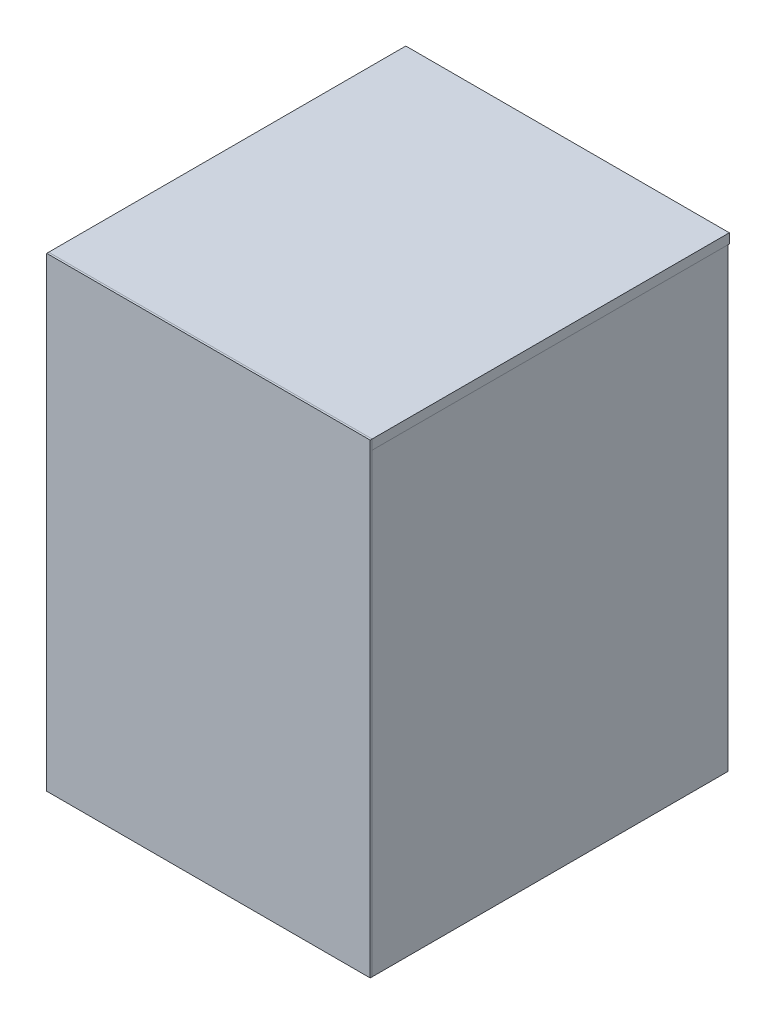
from build123d import *

# Parameters (mm, degrees)
SKETCH1_W                       = 15
SKETCH1_H                       = 705
BOSS_EXTRUDE1_DEPTH             = 550
BOSS_EXTRUDE1_2_DEPTH           = 550
BOSS_EXTRUDE2_START             = 20
SKETCH2_W                       = 470
SKETCH2_H                       = 15
BOSS_EXTRUDE2_DEPTH             = 515
BOSS_EXTRUDE3_START             = -2
SKETCH3_W                       = 500
SKETCH3_H                       = 15
BOSS_EXTRUDE3_DEPTH             = 552
SKETCH4_W                       = 470
SKETCH4_H                       = 15
BOSS_EXTRUDE4_DEPTH             = 50
BOSS_EXTRUDE5_REACH             = 930.453
SKETCH5_W                       = 15
SKETCH5_H                       = 50
SKETCH5_H_2                     = 105
BOSS_EXTRUDE5_DIRECTION_2_REACH = 930.453
SKETCH7_W                       = 500
SKETCH7_H                       = 720
BOSS_EXTRUDE6_DEPTH             = 3
CUT_EXTRUDE2_DEPTH              = 15
ALU_PROFILES_DEPTH              = 585
SKETCH9_R                       = 2.5
CUT_EXTRUDE1_DEPTH              = 2


with BuildPart() as part:
    # Sketch1 → Boss-Extrude1 (new body)
    with BuildSketch(Plane.XY):
        with Locations((-242.5, 337.5)):
            Rectangle(SKETCH1_W, SKETCH1_H)
    extrude(amount=BOSS_EXTRUDE1_DEPTH)



with BuildPart() as body_2:
    # Sketch1 → Boss-Extrude1 2 (new body)
    with BuildSketch(Plane.XY):
        with Locations((242.5, 337.5)):
            Rectangle(SKETCH1_W, SKETCH1_H)
    extrude(amount=BOSS_EXTRUDE1_2_DEPTH)


with BuildPart() as body_3:
    # Sketch2 → Boss-Extrude2 (new body)
    with BuildSketch(Plane.XY.offset(BOSS_EXTRUDE2_START)):
        with Locations((0, -7.5)):
            Rectangle(SKETCH2_W, SKETCH2_H)
    extrude(amount=BOSS_EXTRUDE2_DEPTH)


with BuildPart() as body_4:
    # Sketch3 → Boss-Extrude3 (new body)
    with BuildSketch(Plane.XY.offset(BOSS_EXTRUDE3_START)):
        with Locations((0, 697.5)):
            Rectangle(SKETCH3_W, SKETCH3_H)
    extrude(amount=BOSS_EXTRUDE3_DEPTH)


with BuildPart() as part_1:
    add(part.part)

    add(body_2.part)  # Boss-Extrude4 merges body 2
    # Sketch4 → Boss-Extrude4 (add)
    with BuildSketch(Plane(origin=(0, 0, 20), x_dir=(-1, 0, 0), z_dir=(0, 0, -1))):
        with Locations((0, 592.5)):
            Rectangle(SKETCH4_W, SKETCH4_H)
    extrude(amount=-BOSS_EXTRUDE4_DEPTH)


with BuildPart() as body_4_2:

    # Sketch5 → Boss-Extrude5 (new, up to next)
    with BuildSketch(Plane(origin=(0, 0, 0), x_dir=(0, 0, -1), z_dir=(1, 0, 0)), mode=Mode.PRIVATE) as boss_extrude5_sk1:
        with Locations((-542.5, 665)):
            Rectangle(SKETCH5_W, SKETCH5_H)
    boss_extrude5_tool1 = extrude(boss_extrude5_sk1.sketch, amount=BOSS_EXTRUDE5_REACH, mode=Mode.PRIVATE) - part_1.part
    # Sketch5 → Boss-Extrude5 (new, up to next)
    with BuildSketch(Plane(origin=(0, 0, 0), x_dir=(0, 0, -1), z_dir=(1, 0, 0)), mode=Mode.PRIVATE) as boss_extrude5_sk2:
        with Locations((-77.5, 637.5)):
            Rectangle(SKETCH5_W, SKETCH5_H_2)
    boss_extrude5_tool2 = extrude(boss_extrude5_sk2.sketch, amount=BOSS_EXTRUDE5_REACH, mode=Mode.PRIVATE) - part_1.part
    add(boss_extrude5_tool1.solids().sort_by_distance((0, 665, 542.5))[0])
    add(boss_extrude5_tool2.solids().sort_by_distance((0, 637.5, 77.5))[0])


    # Sketch5 → Boss-Extrude5 direction 2 (add, up to next)
    with BuildSketch(Plane(origin=(0, 0, 0), x_dir=(0, 0, -1), z_dir=(1, 0, 0)), mode=Mode.PRIVATE) as boss_extrude5_direction_2_sk1:
        with Locations((-542.5, 665)):
            Rectangle(SKETCH5_W, SKETCH5_H)
    boss_extrude5_direction_2_tool1 = extrude(boss_extrude5_direction_2_sk1.sketch, amount=-BOSS_EXTRUDE5_DIRECTION_2_REACH, mode=Mode.PRIVATE) - part_1.part
    # Sketch5 → Boss-Extrude5 direction 2 (add, up to next)
    with BuildSketch(Plane(origin=(0, 0, 0), x_dir=(0, 0, -1), z_dir=(1, 0, 0)), mode=Mode.PRIVATE) as boss_extrude5_direction_2_sk2:
        with Locations((-77.5, 637.5)):
            Rectangle(SKETCH5_W, SKETCH5_H_2)
    boss_extrude5_direction_2_tool2 = extrude(boss_extrude5_direction_2_sk2.sketch, amount=-BOSS_EXTRUDE5_DIRECTION_2_REACH, mode=Mode.PRIVATE) - part_1.part
    add(boss_extrude5_direction_2_tool1.solids().sort_by_distance((0, 665, 542.5))[0])
    add(boss_extrude5_direction_2_tool2.solids().sort_by_distance((0, 637.5, 77.5))[0])

    # Sketch10 → Cut-Extrude2 (cut)
    with BuildSketch(Plane(origin=(0, 0, 70), x_dir=(-1, 0, 0), z_dir=(0, 0, -1))):
        with BuildLine():
            Line((-40, 682.5), (40, 682.5))
            ThreePointArc((40, 682.5), (77.5, 645), (40, 607.5))
            Line((40, 607.5), (-40, 607.5))
            ThreePointArc((-40, 607.5), (-77.5, 645), (-40, 682.5))
        make_face()
    extrude(amount=-CUT_EXTRUDE2_DEPTH, mode=Mode.SUBTRACT)


with BuildPart() as body_5:
    # Sketch7 → Boss-Extrude6 (new body)
    with BuildSketch(Plane.XY.offset(550)):
        with Locations((0, 345)):
            Rectangle(SKETCH7_W, SKETCH7_H)
    extrude(amount=BOSS_EXTRUDE6_DEPTH)


with BuildPart() as body_6:
    # Sketch8 → Alu-profiles (new body)
    with BuildSketch(Plane(origin=(0, 0, 0), x_dir=(1, 0, 0), z_dir=(0, 1, 0))):
        Polygon((235, -30), (235, -20), (220, -20), (220, -22), (233, -22), (233, -30), align=None)
    extrude(amount=ALU_PROFILES_DEPTH)


with BuildPart() as body_7:
    # Mirror2: mirrored copy
    add(body_6.part.mirror(Plane(origin=(0, 0, 0), x_dir=(0, 0, 1), z_dir=(1, 0, 0))))


with BuildPart() as cut_extrude1_tool:
    # Sketch9 → Cut-Extrude1 (new body)
    with BuildSketch(Plane(origin=(0, 0, 20), x_dir=(-1, 0, 0), z_dir=(0, 0, -1))):
        with Locations((-225, 517.5)):
            Circle(SKETCH9_R)
        with Locations(Location((-225, 67.5, 0), (0, 0, 180))):
            Circle(SKETCH9_R)
        with Locations((225, 67.5)):
            Circle(SKETCH9_R)
        with Locations(Location((225, 517.5, 0), (0, 0, 180))):
            Circle(SKETCH9_R)
    extrude(amount=-CUT_EXTRUDE1_DEPTH)


with BuildPart() as body_6_1:
    add(body_6.part)

    # Cut-Extrude1: cut by cut_extrude1_tool
    add(cut_extrude1_tool.part, mode=Mode.SUBTRACT)


with BuildPart() as body_7_1:
    add(body_7.part)

    # Cut-Extrude1: cut by cut_extrude1_tool
    add(cut_extrude1_tool.part, mode=Mode.SUBTRACT)


solid = Compound([body_3.part, body_4.part, part_1.part, body_4_2.part, body_5.part, body_6_1.part, body_7_1.part])
